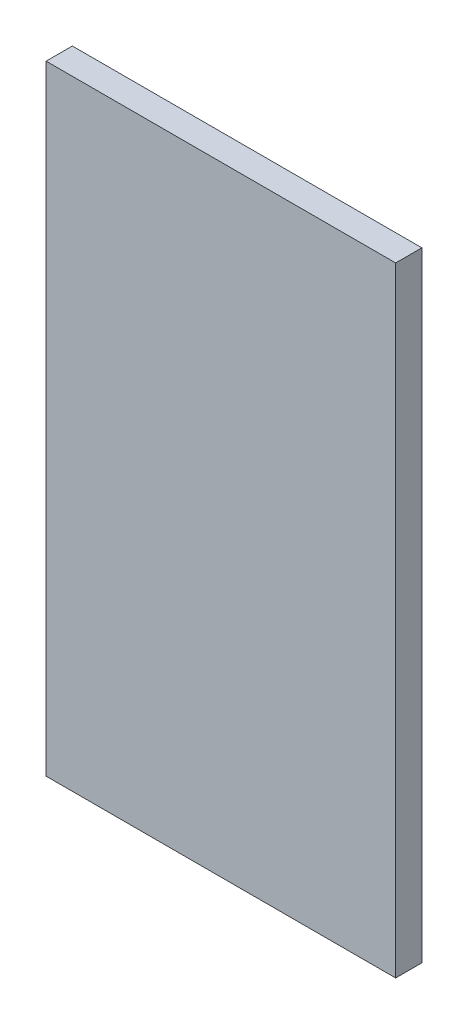
from build123d import *

# Parameters (mm, degrees)
SKETCH2_W           = 508
SKETCH2_H           = 38.1
BOSS_EXTRUDE1_DEPTH = 900


with BuildPart() as part:
    # Sketch2 → Boss-Extrude1 (new body)
    with BuildSketch(Plane(origin=(0, 0, 0), x_dir=(1, 0, 0), z_dir=(0, 1, 0))):
        Rectangle(SKETCH2_W, SKETCH2_H)
    extrude(amount=BOSS_EXTRUDE1_DEPTH)


solid = part.part
